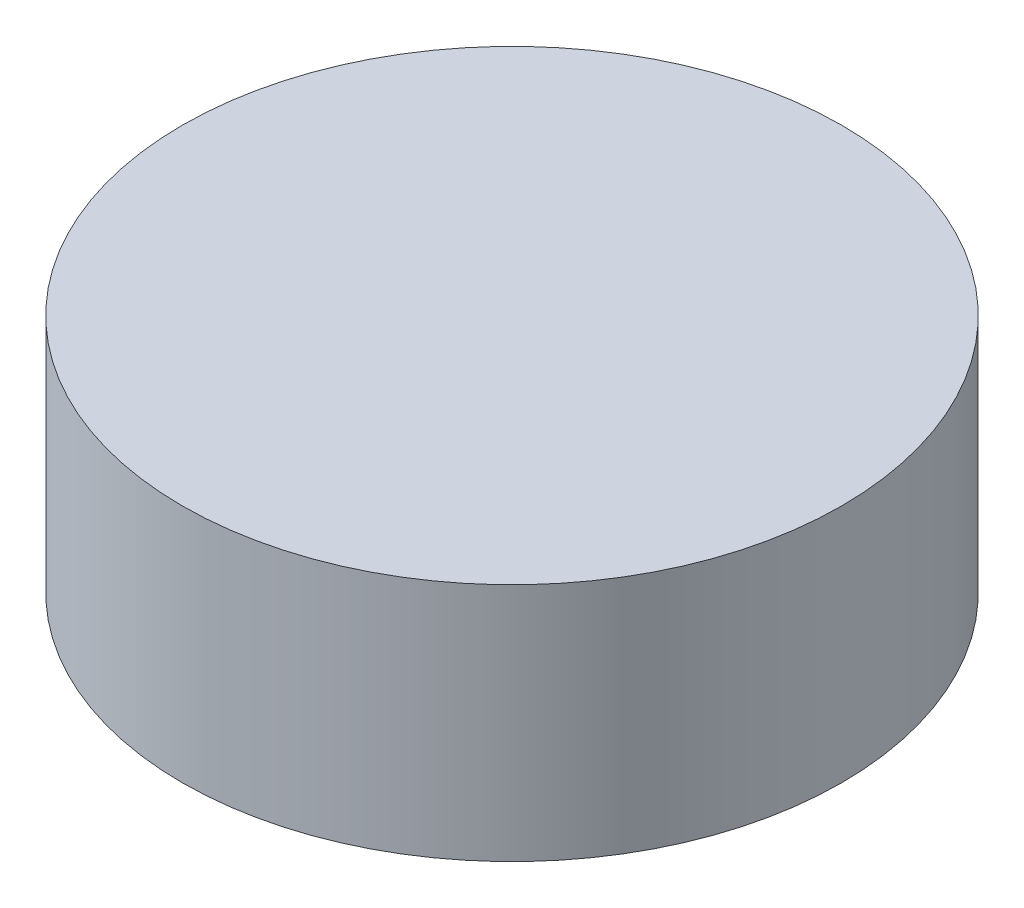
from build123d import *


with BuildPart() as part:
    # Sketch1 → Revolve1 (revolve)
    with BuildSketch(Plane.XY, mode=Mode.PRIVATE) as revolve1_sk:
        Polygon((25.4, 0), (25.4, -17.78), (27.94, -17.78), (27.94, 2.54), (0, 2.54), (0, 0), align=None)
    revolve(revolve1_sk.sketch.rotate(Axis((0, 0, 0), (0, 1, 0)), 90), axis=Axis((0, 0, 0), (0, 1, 0)))


solid = part.part
